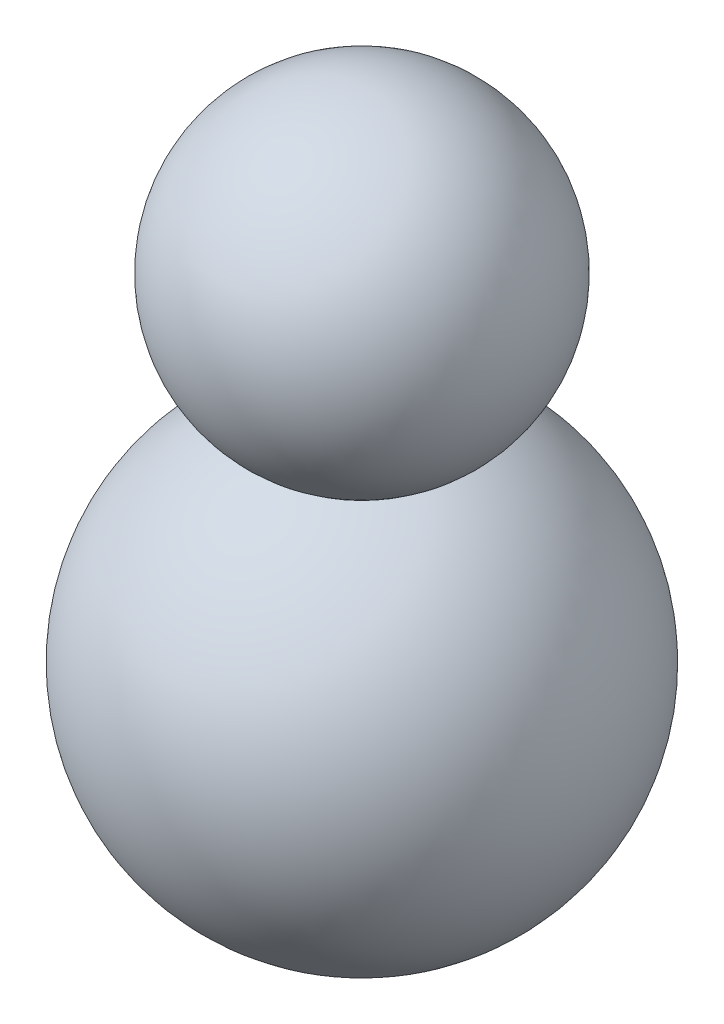
from build123d import *


with BuildPart() as part:
    # 草图1 → 旋转-薄壁3 (revolve)
    with BuildSketch(Plane.XY):
        with BuildLine():
            Line((0, 0), (0, 25))
            ThreePointArc((0, 25), (12.5, 12.5), (0, 0))
        make_face()
        with BuildLine():
            Line((3, 3.486121811), (3, 21.513878189))
            ThreePointArc((3, 21.513878189), (9.5, 12.5), (3, 3.486121811))
        make_face(mode=Mode.SUBTRACT)
    revolve(axis=Axis((0, 0, 0), (0, 1, 0)))

    # 草图4 → 旋转-薄壁4 (revolve)
    with BuildSketch(Plane.XY):
        with BuildLine():
            Line((0, 22.360865449), (0, 40.360865449))
            ThreePointArc((0, 40.360865449), (-9, 31.360865449), (0, 22.360865449))
        make_face()
        with BuildLine():
            Line((-3, 26.164713026), (-3, 36.557017872))
            ThreePointArc((-3, 36.557017872), (-6, 31.360865449), (-3, 26.164713026))
        make_face(mode=Mode.SUBTRACT)
    revolve(axis=Axis((0, 22.360865449, 0), (0, 1, 0)))


solid = part.part
